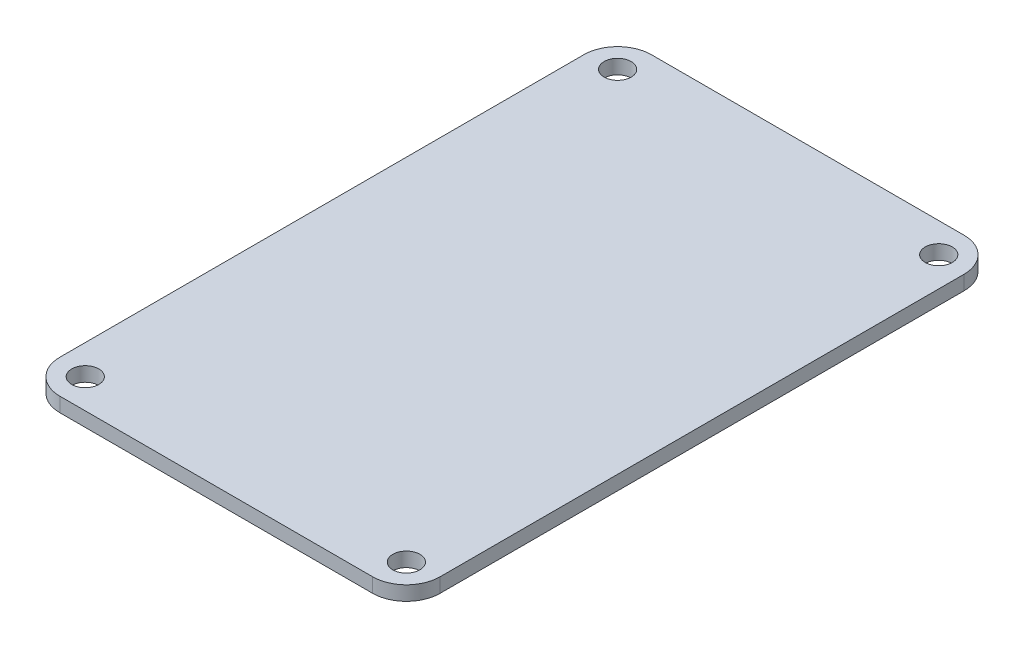
from build123d import *

# Parameters (mm, degrees)
SKETCH1_W            = 45
SKETCH1_H            = 70
MAIN_BODY_DEPTH      = 1.7
M3_CLEARANCE_HOLE1_D = 3.2
MIRROR2_COPY_1_D     = 3.2
FILLET1_R            = 4


with BuildPart() as part:
    # Sketch1 → MAIN BODY (new body)
    with BuildSketch(Plane(origin=(0, 0, 0), x_dir=(1, 0, 0), z_dir=(0, 1, 0))):
        Rectangle(SKETCH1_W, SKETCH1_H)
    extrude(amount=MAIN_BODY_DEPTH)

    # M3 Clearance Hole1 (through all)
    with Locations(Plane(origin=(0, 1.7, 0), x_dir=(1, 0, 0), z_dir=(0, 1, 0))):
        with Locations((-19, 31.5)):
            m3_clearance_hole1 = Hole(M3_CLEARANCE_HOLE1_D / 2)

    # Mirror1: M3 Clearance Hole1 across plane
    add(m3_clearance_hole1.mirror(Plane(origin=(0, 0, 0), x_dir=(0, 0, 1), z_dir=(1, 0, 0))), mode=Mode.SUBTRACT)

    # Mirror2: M3 Clearance Hole1 across plane
    add(m3_clearance_hole1.mirror(Plane.XY), mode=Mode.SUBTRACT)

    # Mirror2 copy 1 (through all)
    with Locations(Plane(origin=(0, 1.7, 0), x_dir=(-1, 0, 0), z_dir=(0, 1, 0))):
        with Locations((-19, 31.5)):
            Hole(MIRROR2_COPY_1_D / 2)

    # Fillet1
    fillet1_edges = [part.edges().sort_by_distance(p)[0] for p in [
        (22.5, 0.85, 35),
        (-22.5, 0.85, 35),
        (-22.5, 0.85, -35),
        (22.5, 0.85, -35),
    ]]
    fillet(fillet1_edges, radius=FILLET1_R)


solid = part.part
